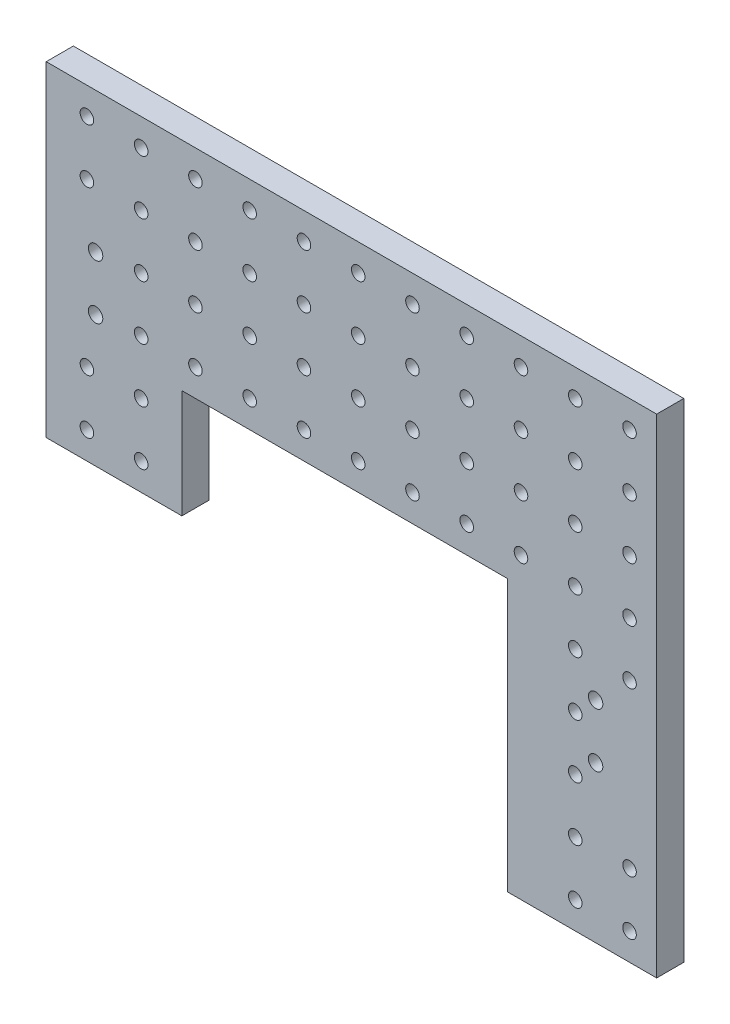
from build123d import *

# Parameters (mm, degrees)
SKETCH1_R           = 3.175
BOSS_EXTRUDE1_DEPTH = 12.7
SKETCH2_R           = 3.175
CUT_EXTRUDE1_DEPTH  = 12.7
SKETCH3_R           = 3.3734375
CUT_EXTRUDE2_DEPTH  = 12.7
CUT_EXTRUDE3_START  = -6.35
SKETCH3_3_R         = 5.55625
SKETCH3_3_R_2       = 3.3734375
CUT_EXTRUDE3_DEPTH  = 6.35
SKETCH5_R           = 3.3734375
CUT_EXTRUDE4_DEPTH  = 12.7
SKETCH5_3_R         = 5.55625
SKETCH5_3_R_2       = 3.3734375
CUT_EXTRUDE5_DEPTH  = 6.35


with BuildPart() as part:
    # Sketch1 → Boss-Extrude1 (new body)
    with BuildSketch(Plane.XY):
        Polygon((0, 152.4), (0, 0), (63.5, 0), (63.5, 50.8), (215.9, 50.8), (215.9, -76.2), (285.75, -76.2), (285.75, 152.4), align=None)
        with Locations((19.05, 12.7)):
            Circle(SKETCH1_R, mode=Mode.SUBTRACT)
        with Locations((19.05, 38.1)):
            Circle(SKETCH1_R, mode=Mode.SUBTRACT)
        with Locations((44.45, 12.7)):
            Circle(SKETCH1_R, mode=Mode.SUBTRACT)
        with Locations((44.45, 38.1)):
            Circle(SKETCH1_R, mode=Mode.SUBTRACT)
        with Locations((247.65, 12.7)):
            Circle(SKETCH1_R, mode=Mode.SUBTRACT)
        with Locations((247.65, 38.1)):
            Circle(SKETCH1_R, mode=Mode.SUBTRACT)
        with Locations((44.45, 63.5)):
            Circle(SKETCH1_R, mode=Mode.SUBTRACT)
        with Locations((69.85, 63.5)):
            Circle(SKETCH1_R, mode=Mode.SUBTRACT)
        with Locations((44.45, 88.9)):
            Circle(SKETCH1_R, mode=Mode.SUBTRACT)
        with Locations((69.85, 88.9)):
            Circle(SKETCH1_R, mode=Mode.SUBTRACT)
        with Locations((95.25, 63.5)):
            Circle(SKETCH1_R, mode=Mode.SUBTRACT)
        with Locations((120.65, 63.5)):
            Circle(SKETCH1_R, mode=Mode.SUBTRACT)
        with Locations((95.25, 88.9)):
            Circle(SKETCH1_R, mode=Mode.SUBTRACT)
        with Locations((120.65, 88.9)):
            Circle(SKETCH1_R, mode=Mode.SUBTRACT)
        with Locations((19.05, 114.3)):
            Circle(SKETCH1_R, mode=Mode.SUBTRACT)
        with Locations((44.45, 114.3)):
            Circle(SKETCH1_R, mode=Mode.SUBTRACT)
        with Locations((69.85, 114.3)):
            Circle(SKETCH1_R, mode=Mode.SUBTRACT)
        with Locations((19.05, 139.7)):
            Circle(SKETCH1_R, mode=Mode.SUBTRACT)
        with Locations((44.45, 139.7)):
            Circle(SKETCH1_R, mode=Mode.SUBTRACT)
        with Locations((69.85, 139.7)):
            Circle(SKETCH1_R, mode=Mode.SUBTRACT)
        with Locations((95.25, 114.3)):
            Circle(SKETCH1_R, mode=Mode.SUBTRACT)
        with Locations((120.65, 114.3)):
            Circle(SKETCH1_R, mode=Mode.SUBTRACT)
        with Locations((95.25, 139.7)):
            Circle(SKETCH1_R, mode=Mode.SUBTRACT)
        with Locations((120.65, 139.7)):
            Circle(SKETCH1_R, mode=Mode.SUBTRACT)
        with Locations((146.05, 63.5)):
            Circle(SKETCH1_R, mode=Mode.SUBTRACT)
        with Locations((171.45, 63.5)):
            Circle(SKETCH1_R, mode=Mode.SUBTRACT)
        with Locations((196.85, 63.5)):
            Circle(SKETCH1_R, mode=Mode.SUBTRACT)
        with Locations((146.05, 88.9)):
            Circle(SKETCH1_R, mode=Mode.SUBTRACT)
        with Locations((171.45, 88.9)):
            Circle(SKETCH1_R, mode=Mode.SUBTRACT)
        with Locations((196.85, 88.9)):
            Circle(SKETCH1_R, mode=Mode.SUBTRACT)
        with Locations((222.25, 63.5)):
            Circle(SKETCH1_R, mode=Mode.SUBTRACT)
        with Locations((247.65, 63.5)):
            Circle(SKETCH1_R, mode=Mode.SUBTRACT)
        with Locations((273.05, 63.5)):
            Circle(SKETCH1_R, mode=Mode.SUBTRACT)
        with Locations((222.25, 88.9)):
            Circle(SKETCH1_R, mode=Mode.SUBTRACT)
        with Locations((247.65, 88.9)):
            Circle(SKETCH1_R, mode=Mode.SUBTRACT)
        with Locations((273.05, 88.9)):
            Circle(SKETCH1_R, mode=Mode.SUBTRACT)
        with Locations((146.05, 114.3)):
            Circle(SKETCH1_R, mode=Mode.SUBTRACT)
        with Locations((171.45, 114.3)):
            Circle(SKETCH1_R, mode=Mode.SUBTRACT)
        with Locations((196.85, 114.3)):
            Circle(SKETCH1_R, mode=Mode.SUBTRACT)
        with Locations((146.05, 139.7)):
            Circle(SKETCH1_R, mode=Mode.SUBTRACT)
        with Locations((171.45, 139.7)):
            Circle(SKETCH1_R, mode=Mode.SUBTRACT)
        with Locations((196.85, 139.7)):
            Circle(SKETCH1_R, mode=Mode.SUBTRACT)
        with Locations((222.25, 114.3)):
            Circle(SKETCH1_R, mode=Mode.SUBTRACT)
        with Locations((247.65, 114.3)):
            Circle(SKETCH1_R, mode=Mode.SUBTRACT)
        with Locations((273.05, 114.3)):
            Circle(SKETCH1_R, mode=Mode.SUBTRACT)
        with Locations((222.25, 139.7)):
            Circle(SKETCH1_R, mode=Mode.SUBTRACT)
        with Locations((247.65, 139.7)):
            Circle(SKETCH1_R, mode=Mode.SUBTRACT)
        with Locations((273.05, 139.7)):
            Circle(SKETCH1_R, mode=Mode.SUBTRACT)
    extrude(amount=BOSS_EXTRUDE1_DEPTH)

    # Sketch2 → Cut-Extrude1 (cut)
    with BuildSketch(Plane.XY.offset(12.7)):
        with Locations((247.65, -12.7)):
            Circle(SKETCH2_R)
        with Locations((247.65, -38.1)):
            Circle(SKETCH2_R)
        with Locations((247.65, -63.5)):
            Circle(SKETCH2_R)
        with Locations((273.05, -38.1)):
            Circle(SKETCH2_R)
        with Locations((273.05, -63.5)):
            Circle(SKETCH2_R)
        with Locations((273.05, 38.1)):
            Circle(SKETCH2_R)
    extrude(amount=-CUT_EXTRUDE1_DEPTH, mode=Mode.SUBTRACT)

    # Sketch3 → Cut-Extrude2 (cut)
    with BuildSketch(Plane.XY.offset(12.7)):
        with Locations((257.175, -3.2258)):
            Circle(SKETCH3_R)
        with Locations((257.175, 22.1742)):
            Circle(SKETCH3_R)
    extrude(amount=-CUT_EXTRUDE2_DEPTH, mode=Mode.SUBTRACT)

    # Sketch3<3> → Cut-Extrude3 (cut)
    # profile 1 of 2: a face of its own
    with BuildSketch(Plane.XY.offset(12.7).offset(CUT_EXTRUDE3_START)):
        with Locations((257.175, -3.2258)):
            Circle(SKETCH3_3_R)
        with Locations((257.175, -3.2258)):
            Circle(SKETCH3_3_R_2, mode=Mode.SUBTRACT)
    # profile 2 of 2: a face of its own
    with BuildSketch(Plane.XY.offset(12.7).offset(CUT_EXTRUDE3_START)):
        with Locations((257.175, 22.1742)):
            Circle(SKETCH3_3_R)
        with Locations((257.175, 22.1742)):
            Circle(SKETCH3_3_R_2, mode=Mode.SUBTRACT)
    extrude(amount=-CUT_EXTRUDE3_DEPTH, mode=Mode.SUBTRACT)

    # Sketch5 → Cut-Extrude4 (cut)
    with BuildSketch(Plane(origin=(0, 0, 0), x_dir=(-1, 0, 0), z_dir=(0, 0, -1))):
        with Locations((-23.114, 61.3918)):
            Circle(SKETCH5_R)
        with Locations((-23.114, 86.7918)):
            Circle(SKETCH5_R)
    extrude(amount=-CUT_EXTRUDE4_DEPTH, mode=Mode.SUBTRACT)

    # Sketch5<3> → Cut-Extrude5 (cut)
    # profile 1 of 2: a face of its own
    with BuildSketch(Plane(origin=(0, 0, 0), x_dir=(-1, 0, 0), z_dir=(0, 0, -1))):
        with Locations(Location((-23.114, 61.3918, 0), (0, 0, 180))):
            Circle(SKETCH5_3_R)
        with Locations((-23.114, 61.3918)):
            Circle(SKETCH5_3_R_2, mode=Mode.SUBTRACT)
    # profile 2 of 2: a face of its own
    with BuildSketch(Plane(origin=(0, 0, 0), x_dir=(-1, 0, 0), z_dir=(0, 0, -1))):
        with Locations(Location((-23.114, 86.7918, 0), (0, 0, 180))):
            Circle(SKETCH5_3_R)
        with Locations((-23.114, 86.7918)):
            Circle(SKETCH5_3_R_2, mode=Mode.SUBTRACT)
    extrude(amount=-CUT_EXTRUDE5_DEPTH, mode=Mode.SUBTRACT)


solid = part.part
